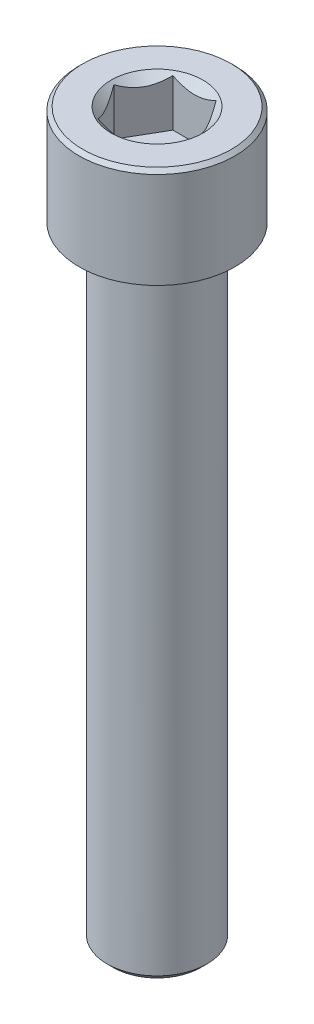
from build123d import *

# Parameters (mm, degrees)
WYCI_GNI_CIE1_DEPTH        = 4
SFAZOWANIE1_SIZE           = 0.3
SZKIC3_R                   = 3.68172134
WYTNIJ_WYCI_GNI_CIE1_DEPTH = 2
WYTNIJ_WYCI_GNI_CIE1_DRAFT = -45
SFAZOWANIE2_SIZE           = 0.5


with BuildPart() as part:
    # Szkic1 → Obrót1 (revolve)
    with BuildSketch(Plane.XY, mode=Mode.PRIVATE) as obr_t1_sk:
        Polygon((0, 0), (-4, 0), (-4, 50), (-6.25, 50), (-6.25, 58), (0, 58), align=None)
    revolve(obr_t1_sk.sketch.rotate(Axis((0, 0, 0), (0, 1, 0)), 270), axis=Axis((0, 0, 0), (0, 1, 0)))

    # Szkic2 → Wyciągnięcie1 (cut)
    with BuildSketch(Plane(origin=(0, 58, 0), x_dir=(1, 0, 0), z_dir=(0, 1, 0))):
        Polygon((3.464101615, 0), (1.732050808, 3), (-1.732050808, 3), (-3.464101615, 0), (-1.732050808, -3), (1.732050808, -3), align=None)
    extrude(amount=-WYCI_GNI_CIE1_DEPTH, mode=Mode.SUBTRACT)

    # Sfazowanie1
    sfazowanie1_edges = [part.edges().sort_by_distance(p)[0] for p in [
        (0, 58, 6.25),
    ]]
    chamfer(sfazowanie1_edges, length=SFAZOWANIE1_SIZE)


with BuildPart() as wytnij_wyci_gni_cie1_tool:
    # Szkic3 → Wytnij-wyciągnięcie1 (with draft: the straight prism first)
    with BuildSketch(Plane(origin=(0, 58, 0), x_dir=(1, 0, 0), z_dir=(0, 1, 0))):
        Circle(SZKIC3_R)
    extrude(amount=-WYTNIJ_WYCI_GNI_CIE1_DEPTH)
    # Wytnij-wyciągnięcie1: the draft: its side faces are tilted about the plane it starts from
    wytnij_wyci_gni_cie1_sides = [wytnij_wyci_gni_cie1_tool.faces().sort_by_distance(p)[0] for p in [
        (-3.68172134, 57, 0),
    ]]
    draft(wytnij_wyci_gni_cie1_sides, Plane(origin=(0, 58, 0), x_dir=(1, 0, 0), z_dir=(0, 1, 0)), WYTNIJ_WYCI_GNI_CIE1_DRAFT)


with BuildPart() as part_1:
    add(part.part)

    # Wytnij-wyciągnięcie1: cut by wytnij_wyci_gni_cie1_tool
    add(wytnij_wyci_gni_cie1_tool.part, mode=Mode.SUBTRACT)

    # Sfazowanie2
    sfazowanie2_edges = [part_1.edges().sort_by_distance(p)[0] for p in [
        (0, 0, 4),
    ]]
    chamfer(sfazowanie2_edges, length=SFAZOWANIE2_SIZE)


solid = part_1.part
